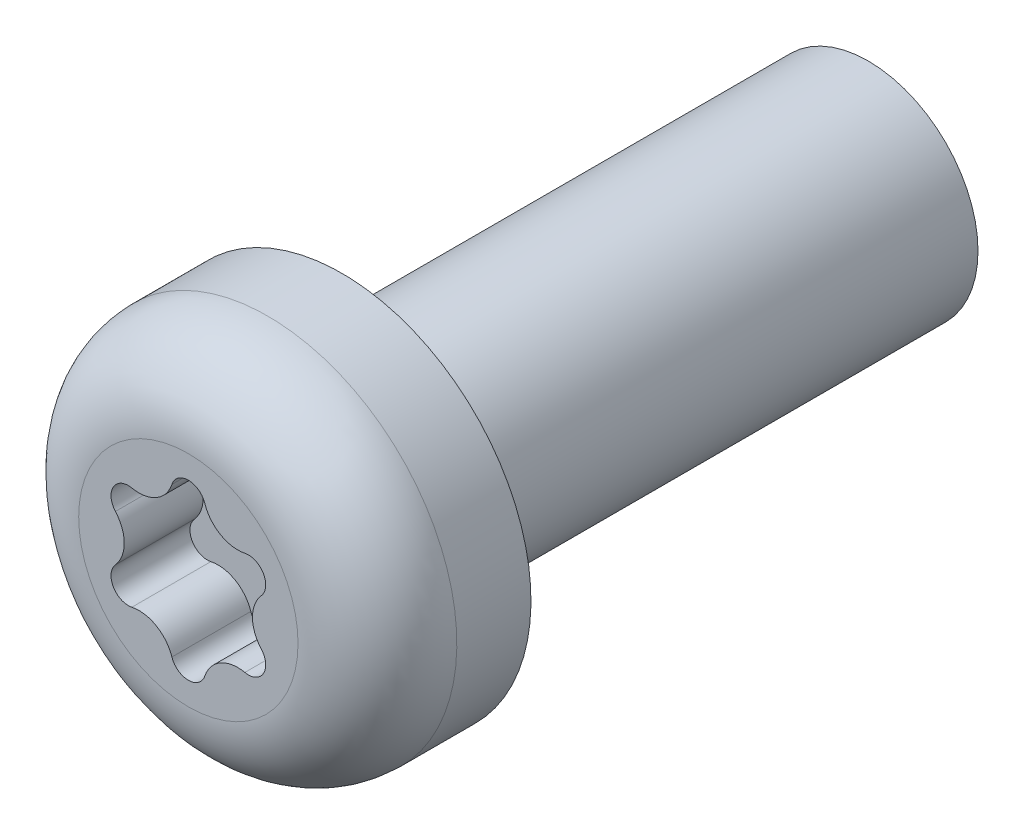
from build123d import *

# Parameters (mm, degrees)
CUT_EXTRUDE1_DEPTH = 1.8
CIRPATTERN1_COUNT  = 6


with BuildPart() as part:
    # Sketch1 → Revolve1 (revolve)
    with BuildSketch(Plane(origin=(0, 0, 0), x_dir=(0, 0, -1), z_dir=(1, 0, 0))):
        with BuildLine():
            Line((-3.5, 0), (-3.5, 2.5))
            ThreePointArc((-3.5, 2.5), (-2.969863274, 3.779863274), (-1.69, 4.31))
            Line((-1.69, 4.31), (0, 4.31))
            Line((0, 4.31), (0, 2.5))
            Line((0, 2.5), (12, 2.5))
            Line((12, 2.5), (12, 0))
            Line((12, 0), (-3.5, 0))
        make_face()
    revolve(axis=Axis((0, 0, 5.584882278), (0, 0, -1)))

    # Sketch2 → Cut-Extrude1 (cut)
    with BuildSketch(Plane.XY.offset(3.5)):
        with BuildLine():
            Line((-0.730783495, 1.265754142), (0, 0))
            Line((0, 0), (0.730783495, 1.265754142))
            ThreePointArc((0.730783495, 1.265754142), (0.512661987, 1.451735511), (0.375261165, 1.703304737))
            ThreePointArc((0.375261165, 1.703304737), (0, 1.975), (-0.375261165, 1.703304737))
            ThreePointArc((-0.375261165, 1.703304737), (-0.512661987, 1.451735511), (-0.730783495, 1.265754142))
        make_face()
    cut_extrude1 = extrude(amount=-CUT_EXTRUDE1_DEPTH, mode=Mode.SUBTRACT)

    # CirPattern1: Cut-Extrude1 ×6 about axis
    cirpattern1_axis = Axis((0, 0, 5.584882278), (0, 0, 1))
    for i in range(1, CIRPATTERN1_COUNT):
        add(cut_extrude1.rotate(cirpattern1_axis, i * 360 / CIRPATTERN1_COUNT), mode=Mode.SUBTRACT)


solid = part.part
